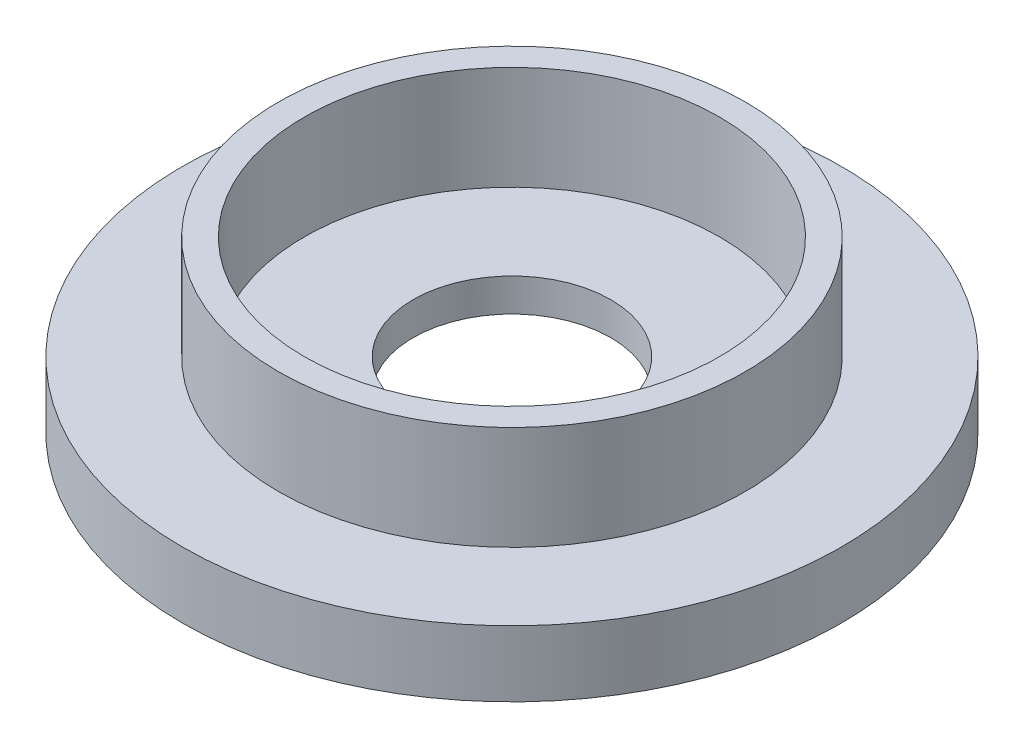
from build123d import *

# Parameters (mm, degrees)
SKETCH1_R           = 63.5
SKETCH1_R_2         = 19.05
BOSS_EXTRUDE1_DEPTH = 12.7
SKETCH2_R           = 57.15
CUT_EXTRUDE1_DEPTH  = 6.35
SKETCH3_R           = 45
SKETCH3_R_2         = 40
BOSS_EXTRUDE3_DEPTH = 20


with BuildPart() as part:
    # Sketch1 → Boss-Extrude1 (new body)
    with BuildSketch(Plane(origin=(0, 0, 0), x_dir=(1, 0, 0), z_dir=(0, 1, 0))):
        Circle(SKETCH1_R)
        Circle(SKETCH1_R_2, mode=Mode.SUBTRACT)
    extrude(amount=BOSS_EXTRUDE1_DEPTH)

    # Sketch2 → Cut-Extrude1 (cut)
    with BuildSketch(Plane.XZ):
        Circle(SKETCH2_R)
    extrude(amount=-CUT_EXTRUDE1_DEPTH, mode=Mode.SUBTRACT)

    # Sketch3 → Boss-Extrude3 (add)
    with BuildSketch(Plane(origin=(0, 12.7, 0), x_dir=(1, 0, 0), z_dir=(0, 1, 0))):
        Circle(SKETCH3_R)
        Circle(SKETCH3_R_2, mode=Mode.SUBTRACT)
    extrude(amount=BOSS_EXTRUDE3_DEPTH)


solid = part.part
